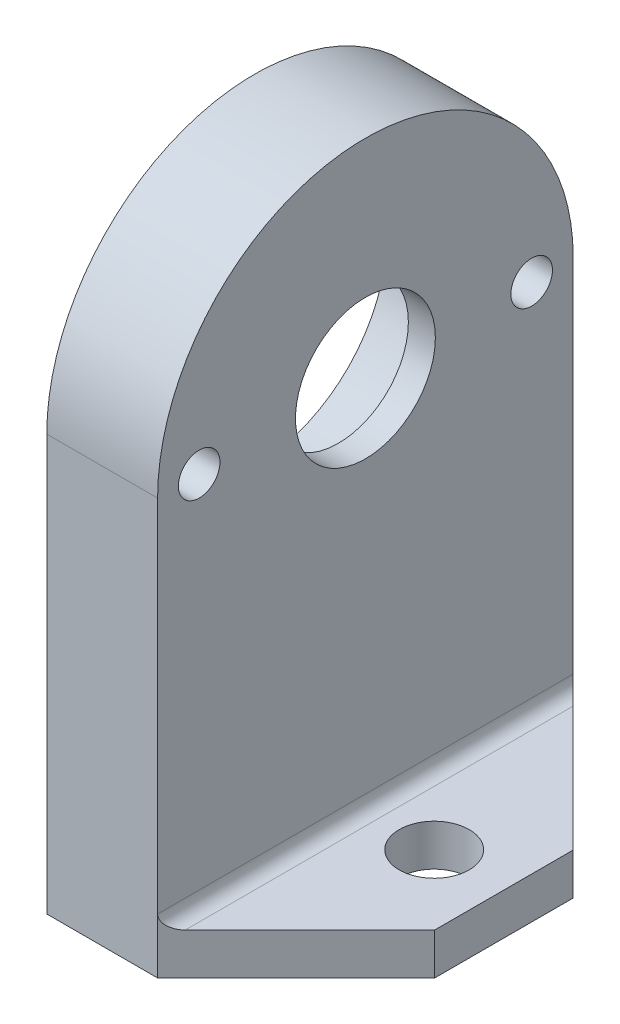
from build123d import *

# Parameters (mm, degrees)
SKETCH2_R           = 1.5
SKETCH2_R_2         = 9.525
BOSS_EXTRUDE1_DEPTH = 4
BOSS_EXTRUDE2_START = 2.05
SKETCH2_4_R         = 9.525
SKETCH2_4_R_2       = 5.05
BOSS_EXTRUDE2_DEPTH = 1.95
SKETCH3_W           = 10
SKETCH3_H           = 30
BOSS_EXTRUDE3_DEPTH = 3
SKETCH4_R           = 2.525
CUT_EXTRUDE1_DEPTH  = 50.457052076
CHAMFER1_SIZE       = 10
FILLET2_R           = 1


with BuildPart() as part:
    # Sketch2 → Boss-Extrude1 (new, symmetric)
    with BuildSketch(Plane(origin=(0, 0, 0), x_dir=(0, 0, -1), z_dir=(1, 0, 0))):
        with BuildLine():
            Line((15, 0), (15, 30))
            ThreePointArc((15, 30), (0, 45), (-15, 30))
            Line((-15, 30), (-15, 0))
            Line((-15, 0), (15, 0))
        make_face()
        with Locations((-12, 30)):
            Circle(SKETCH2_R, mode=Mode.SUBTRACT)
        with Locations((0, 30)):
            Circle(SKETCH2_R_2, mode=Mode.SUBTRACT)
        with Locations((12, 30)):
            Circle(SKETCH2_R, mode=Mode.SUBTRACT)
    extrude(amount=BOSS_EXTRUDE1_DEPTH, both=True)

    # Sketch2<4> → Boss-Extrude2 (add)
    with BuildSketch(Plane(origin=(0, 0, 0), x_dir=(0, 0, -1), z_dir=(1, 0, 0)).offset(BOSS_EXTRUDE2_START)):
        with Locations((0, 30)):
            Circle(SKETCH2_4_R)
        with Locations((0, 30)):
            Circle(SKETCH2_4_R_2, mode=Mode.SUBTRACT)
    extrude(amount=BOSS_EXTRUDE2_DEPTH)

    # Sketch3 → Boss-Extrude3 (add)
    with BuildSketch(Plane.XZ):
        with Locations((9, 0)):
            Rectangle(SKETCH3_W, SKETCH3_H)
    extrude(amount=-BOSS_EXTRUDE3_DEPTH)

    # Sketch4 → Cut-Extrude1 (cut, through all)
    with BuildSketch(Plane(origin=(0, 0, 0), x_dir=(-1, 0, 0), z_dir=(0, -1, 0))):
        with Locations(Location((-8.964181233, 0, 0), (0, 0, 90))):
            Circle(SKETCH4_R)
    extrude(amount=-CUT_EXTRUDE1_DEPTH, mode=Mode.SUBTRACT)

    # Chamfer1
    chamfer1_edges = [part.edges().sort_by_distance(p)[0] for p in [
        (14, 1.5, -15),
        (14, 1.5, 15),
    ]]
    chamfer(chamfer1_edges, length=CHAMFER1_SIZE)

    # Fillet2
    fillet2_edges = [part.edges().sort_by_distance(p)[0] for p in [
        (4, 3, 0),
    ]]
    fillet(fillet2_edges, radius=FILLET2_R)


solid = part.part
